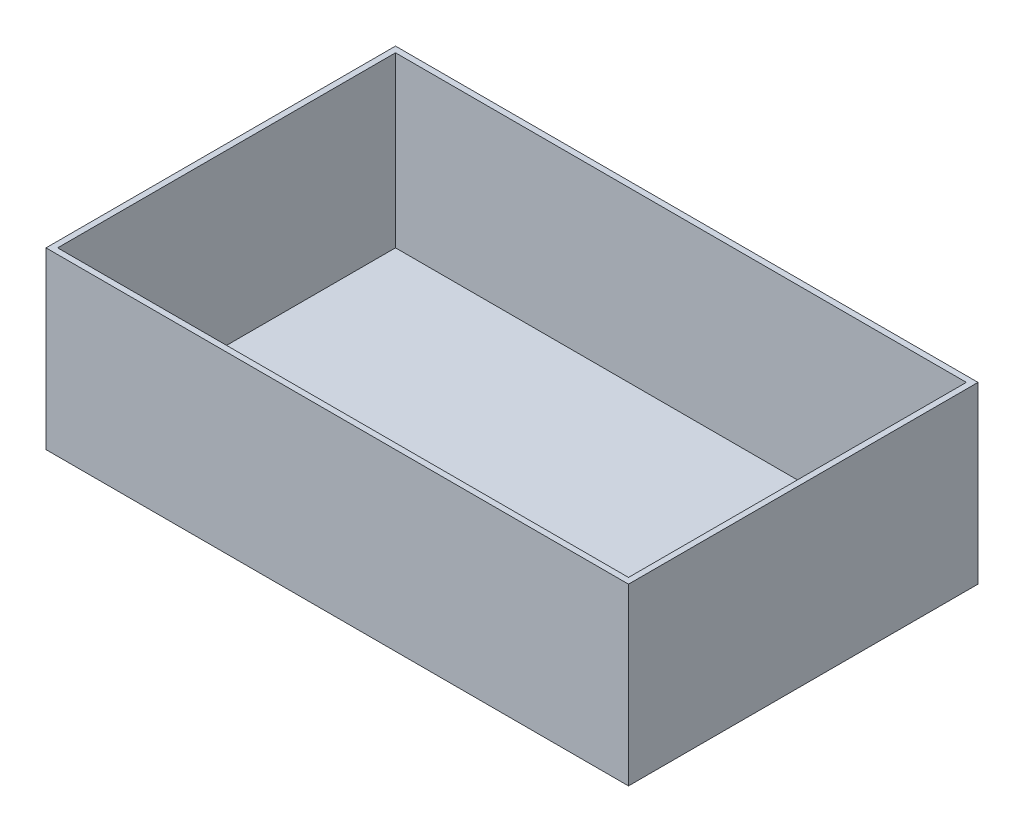
from build123d import *

# Parameters (mm, degrees)
SKETCH1_W           = 500
SKETCH1_H           = 300
BOSS_EXTRUDE1_DEPTH = 5
SKETCH2_W           = 500
SKETCH2_H           = 300
SKETCH2_W_2         = 490
SKETCH2_H_2         = 290
BOSS_EXTRUDE2_DEPTH = 145


with BuildPart() as part:
    # Sketch1 → Boss-Extrude1 (new body)
    with BuildSketch(Plane(origin=(0, 0, 0), x_dir=(1, 0, 0), z_dir=(0, 1, 0))):
        Rectangle(SKETCH1_W, SKETCH1_H)
    extrude(amount=BOSS_EXTRUDE1_DEPTH)

    # Sketch2 → Boss-Extrude2 (add)
    with BuildSketch(Plane(origin=(0, 5, 0), x_dir=(1, 0, 0), z_dir=(0, 1, 0))):
        Rectangle(SKETCH2_W, SKETCH2_H)
        Rectangle(SKETCH2_W_2, SKETCH2_H_2, mode=Mode.SUBTRACT)
    extrude(amount=BOSS_EXTRUDE2_DEPTH)


solid = part.part
